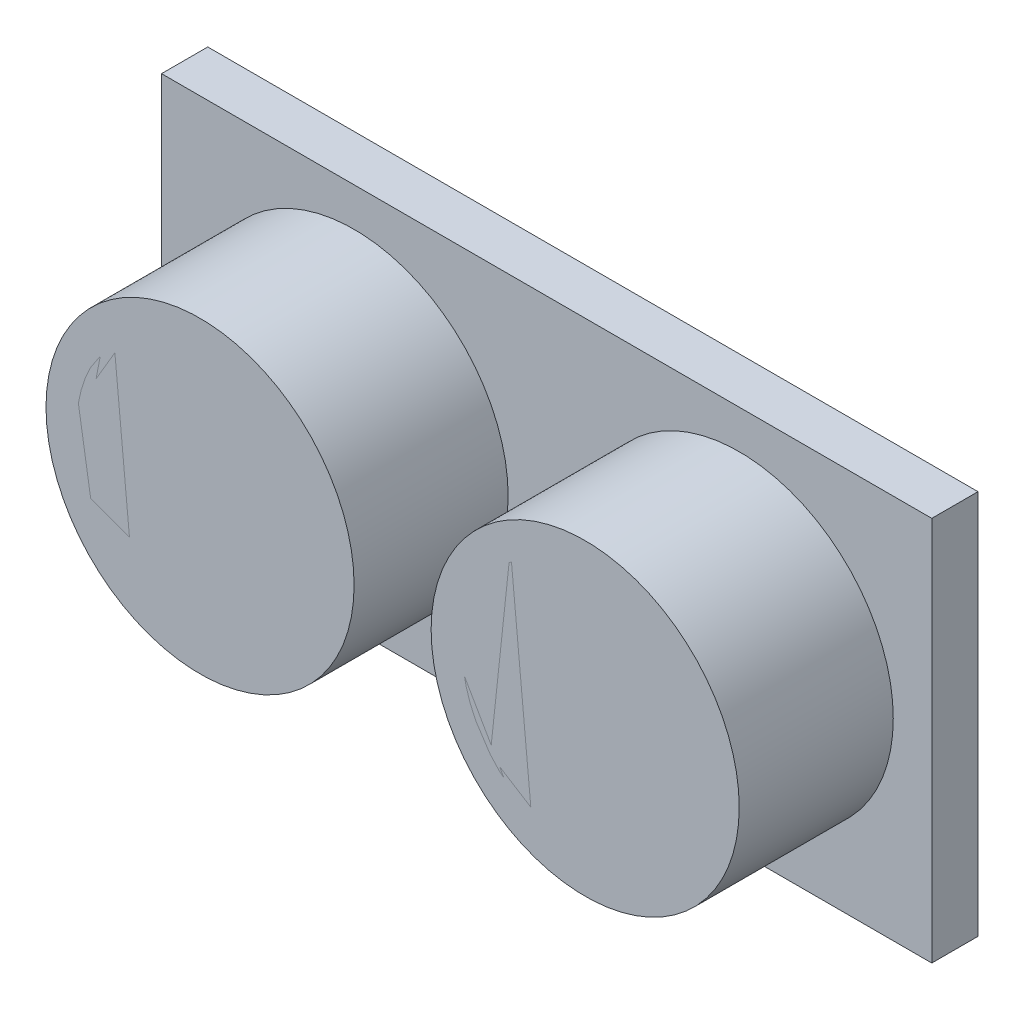
from build123d import *

# Parameters (mm, degrees)
SKETCH_1_W      = 50
SKETCH_1_H      = 25
EXTRUDE_1_DEPTH = 3
SKETCH_2_R      = 10
EXTRUDE_2_DEPTH = 10
SKETCH_3_R      = 8
EXTRUDE_3_DEPTH = 5
SKETCH_4_R      = 8
EXTRUDE_4_DEPTH = 5


with BuildPart() as part:
    # 草图1 → 凸台-拉伸1 (new body)
    with BuildSketch(Plane.XY):
        with Locations((25, 12.5)):
            Rectangle(SKETCH_1_W, SKETCH_1_H)
    extrude(amount=EXTRUDE_1_DEPTH)

    # 草图2 → 凸台-拉伸2 (add)
    with BuildSketch(Plane.XY.offset(3)):
        with Locations((12.5, 12.5)):
            Circle(SKETCH_2_R)
        with Locations(Location((37.5, 12.5, 0), (0, 0, 180))):
            Circle(SKETCH_2_R)
    extrude(amount=EXTRUDE_2_DEPTH)


with BuildPart() as body_2:
    # 草图3 → 凸台-拉伸3 (new body)
    with BuildSketch(Plane.XY.offset(13)):
        with Locations((12.5, 12.5)):
            Circle(SKETCH_3_R)
    extrude(amount=-EXTRUDE_3_DEPTH)


with BuildPart() as body_3:
    # 草图4 → 凸台-拉伸4 (new body)
    with BuildSketch(Plane.XY.offset(13)):
        with Locations((37.5, 12.5)):
            Circle(SKETCH_4_R)
    extrude(amount=-EXTRUDE_4_DEPTH)


solid = Compound([part.part, body_2.part, body_3.part])
